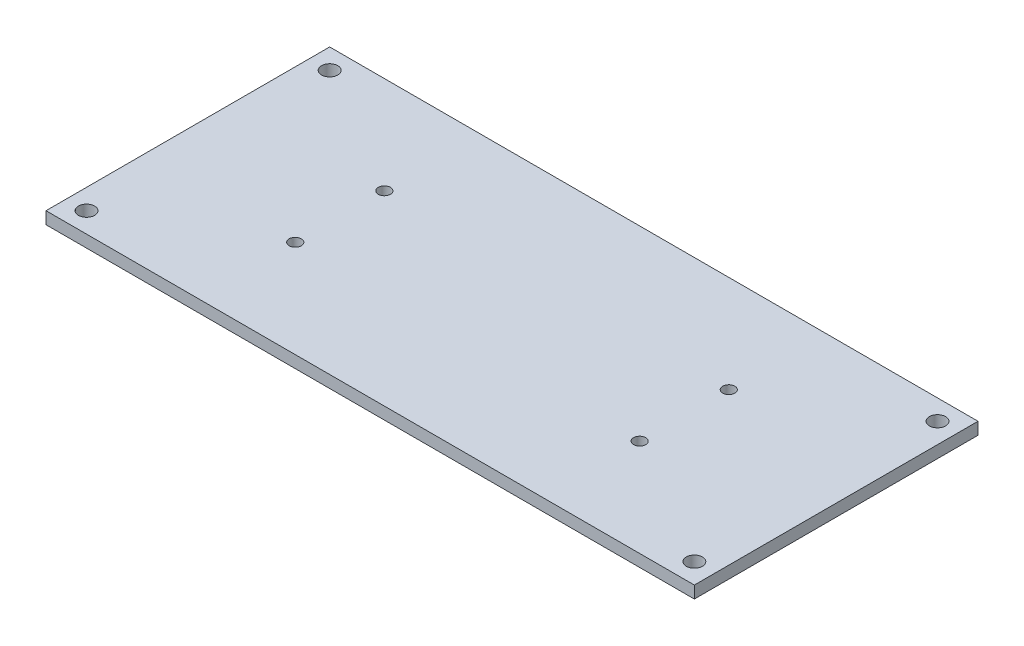
from build123d import *

# Parameters (mm, degrees)
SKETCH1_W      = 160
SKETCH1_H      = 70
EXTRUDE1_DEPTH = 3
SKETCH2_R      = 2
EXTRUDE2_DEPTH = 120
SKETCH3_R      = 1.5
EXTRUDE3_DEPTH = 10


with BuildPart() as part:
    # Sketch1 → Extrude1 (new body)
    with BuildSketch(Plane(origin=(0, 0, 0), x_dir=(1, 0, 0), z_dir=(0, 1, 0))):
        Rectangle(SKETCH1_W, SKETCH1_H)
    extrude(amount=EXTRUDE1_DEPTH)

    # Sketch2 → Extrude2 (cut)
    with BuildSketch(Plane(origin=(0, 3, 0), x_dir=(1, 0, 0), z_dir=(0, 1, 0))):
        with Locations(Location((-75, 30, 0), (0, 0, 270))):
            Circle(SKETCH2_R)
        with Locations(Location((-75, -30, 0), (0, 0, 270))):
            Circle(SKETCH2_R)
        with Locations(Location((75, -30, 0), (0, 0, 270))):
            Circle(SKETCH2_R)
        with Locations(Location((75, 30, 0), (0, 0, 270))):
            Circle(SKETCH2_R)
    extrude(amount=-EXTRUDE2_DEPTH, mode=Mode.SUBTRACT)

    # Sketch3 → Extrude3 (cut)
    with BuildSketch(Plane(origin=(0, 3, 0), x_dir=(1, 0, 0), z_dir=(0, 1, 0))):
        with Locations(Location((-42.5, 11, 0), (0, 0, 270))):
            Circle(SKETCH3_R)
        with Locations(Location((-42.5, -11, 0), (0, 0, 270))):
            Circle(SKETCH3_R)
        with Locations(Location((42.5, -11, 0), (0, 0, 270))):
            Circle(SKETCH3_R)
        with Locations(Location((42.5, 11, 0), (0, 0, 270))):
            Circle(SKETCH3_R)
    extrude(amount=-EXTRUDE3_DEPTH, mode=Mode.SUBTRACT)


solid = part.part
